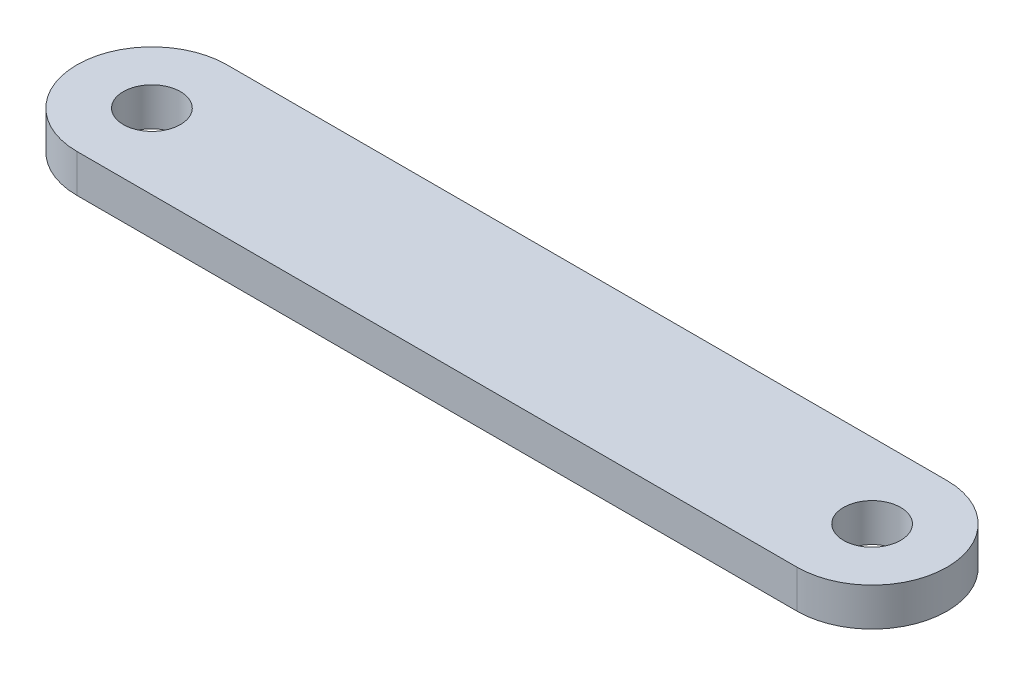
from build123d import *

# Parameters (mm, degrees)
SKETCH1_R           = 2.38
BOSS_EXTRUDE1_DEPTH = 3.175


with BuildPart() as part:
    # Sketch1 → Boss-Extrude1 (new body)
    with BuildSketch(Plane(origin=(0, 0, 0), x_dir=(1, 0, 0), z_dir=(0, 1, 0))):
        with BuildLine():
            Line((-30, 6.25), (30, 6.25))
            ThreePointArc((30, 6.25), (36.25, 0), (30, -6.25))
            Line((30, -6.25), (-30, -6.25))
            ThreePointArc((-30, -6.25), (-36.25, 0), (-30, 6.25))
        make_face()
        with Locations(Location((-30, 0, 0), (0, 0, 270))):
            Circle(SKETCH1_R, mode=Mode.SUBTRACT)
        with Locations(Location((30, 0, 0), (0, 0, 270))):
            Circle(SKETCH1_R, mode=Mode.SUBTRACT)
    extrude(amount=BOSS_EXTRUDE1_DEPTH)


solid = part.part
